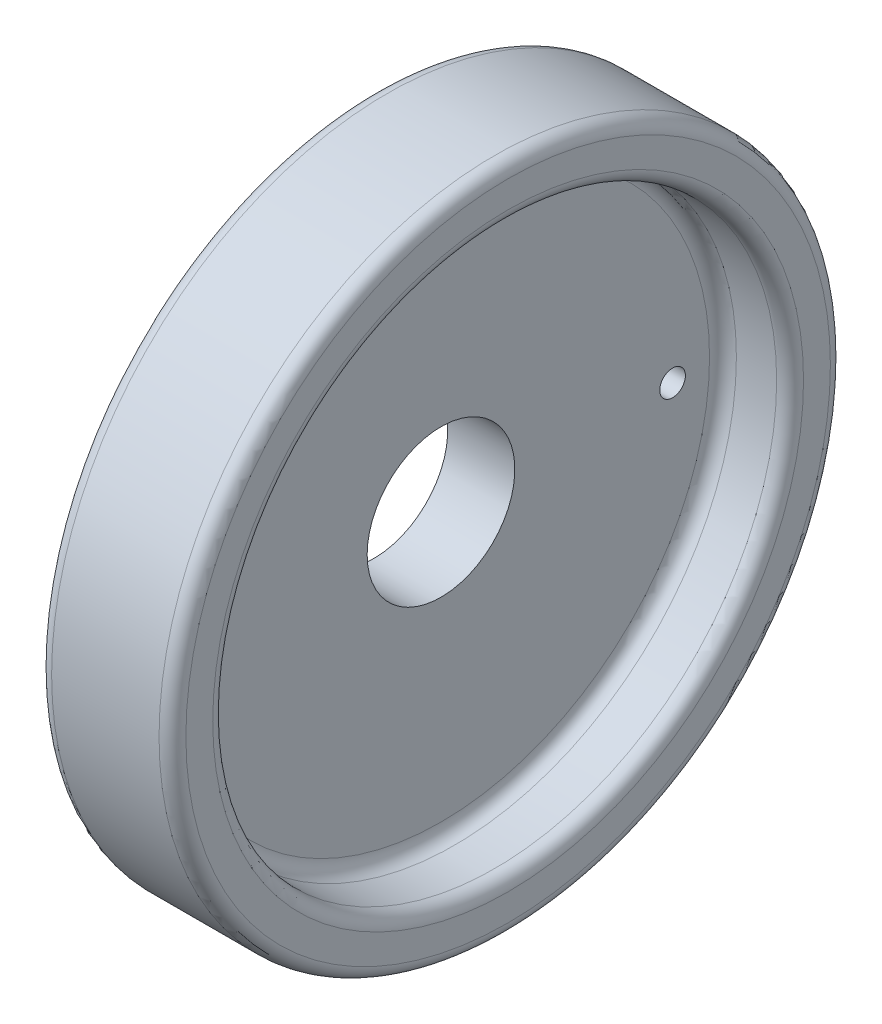
from build123d import *

# Parameters (mm, degrees)
CUT_EXTRUDE1_REACH = 19.854
SKETCH4_R          = 0.477810363


with BuildPart() as part:
    # Sketch2 → Revolve1 (revolve)
    with BuildSketch(Plane.XY, mode=Mode.PRIVATE) as revolve1_sk:
        with BuildLine():
            Line((0, 2.75), (0, 12))
            ThreePointArc((0, 12), (0.146446609, 12.353553391), (0.5, 12.5))
            Line((0.5, 12.5), (4.5, 12.5))
            ThreePointArc((4.5, 12.5), (4.853553391, 12.353553391), (5, 12))
            Line((5, 12), (5, 11))
            ThreePointArc((5, 11), (4.853553391, 10.646446609), (4.5, 10.5))
            Line((4.5, 10.5), (3, 10.5))
            ThreePointArc((3, 10.5), (2.646446609, 10.353553391), (2.5, 10))
            Line((2.5, 10), (2.5, 2.75))
            Line((2.5, 2.75), (0, 2.75))
        make_face()
    revolve(revolve1_sk.sketch.rotate(Axis((0, 0, 0), (1, 0, 0)), 90), axis=Axis((0, 0, 0), (1, 0, 0)))

    # Sketch4 → Cut-Extrude1 (cut, up to next)
    with BuildSketch(Plane(origin=(2.5, 0, 0), x_dir=(0, 0, -1), z_dir=(1, 0, 0)), mode=Mode.PRIVATE) as cut_extrude1_sk1:
        with Locations((8.623339412, -0.147893684)):
            Circle(SKETCH4_R)
    cut_extrude1_tool1 = extrude(cut_extrude1_sk1.sketch, amount=-CUT_EXTRUDE1_REACH, mode=Mode.PRIVATE) & part.part
    add(cut_extrude1_tool1.solids().sort_by_distance((2.5, -0.147894, -8.623339))[0], mode=Mode.SUBTRACT)


solid = part.part
